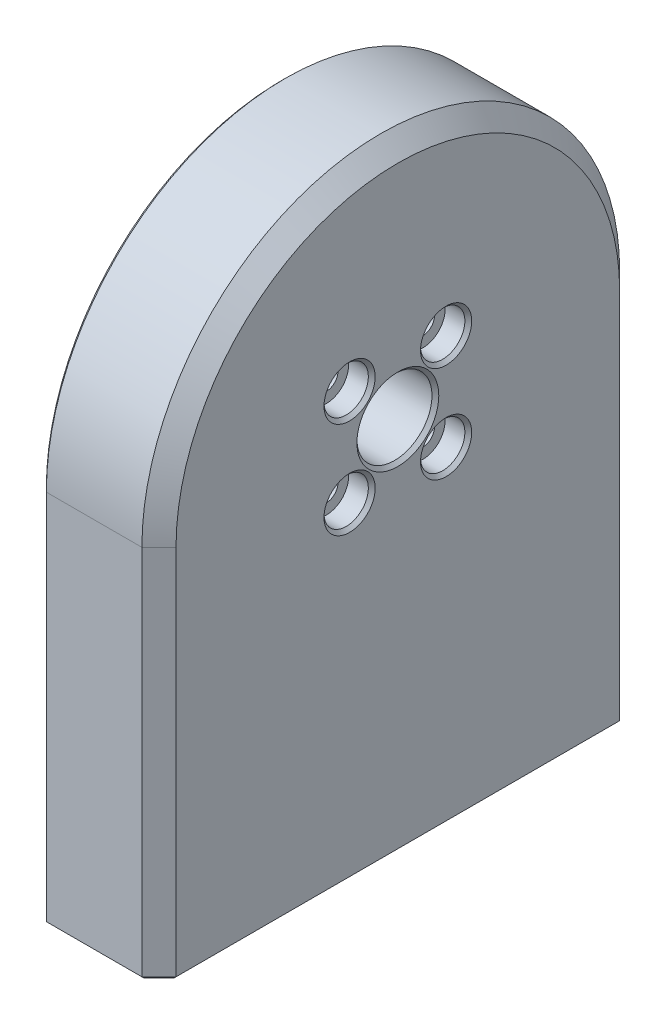
from build123d import *

# Parameters (mm, degrees)
SKETCH1_R                                           = 35
SKETCH1_R_2                                         = 5.5
SKETCH1_R_3                                         = 17
BOSS_EXTRUDE1_DEPTH                                 = 17
BOSS_EXTRUDE2_START                                 = -0.5
SKETCH1_3_R                                         = 17
SKETCH1_3_R_2                                       = 5.5
BOSS_EXTRUDE2_DEPTH                                 = 0.5
CBORE_FOR_M3_HEX_SOCKET_HEAD_CAP_SCREW1_D           = 3.4
CBORE_FOR_M3_HEX_SOCKET_HEAD_CAP_SCREW1_CBORE_D     = 6.5
CBORE_FOR_M3_HEX_SOCKET_HEAD_CAP_SCREW1_CBORE_DEPTH = 3.4
F_5_6_5_6_DIAMETER_HOLE1_D                          = 5.6
F_5_6_5_6_DIAMETER_HOLE1_DEPTH                      = 8
F_5_6_5_6_DIAMETER_HOLE1_TIP                        = 1.682409733
F_2_5MM_CHAMFER1_SIZE                               = 2.5
F_0_5MM_CHAMFER2_SIZE                               = 0.5


with BuildPart() as part:
    # Sketch1 → Boss-Extrude1 (new body)
    # profile 1 of 3: a face of its own
    with BuildSketch(Plane(origin=(0, 0, 0), x_dir=(0, 0, -1), z_dir=(1, 0, 0))):
        Circle(SKETCH1_R)
        Circle(SKETCH1_R_2, mode=Mode.SUBTRACT)
    # profile 2 of 3: a face of its own
    with BuildSketch(Plane(origin=(0, 0, 0), x_dir=(0, 0, -1), z_dir=(1, 0, 0))):
        with BuildLine():
            ThreePointArc((35, 0), (0, -35), (-35, 0))
            Line((-35, 0), (-35, -55))
            Line((-35, -55), (35, -55))
            Line((35, -55), (35, 0))
        make_face()
    # profile 3 of 3: a face of its own
    with BuildSketch(Plane(origin=(0, 0, 0), x_dir=(0, 0, -1), z_dir=(1, 0, 0))):
        Circle(SKETCH1_R_3)
        Circle(SKETCH1_R_2, mode=Mode.SUBTRACT)
    extrude(amount=BOSS_EXTRUDE1_DEPTH)

    # Sketch1<3> → Boss-Extrude2 (add)
    with BuildSketch(Plane(origin=(0, 0, 0), x_dir=(0, 0, -1), z_dir=(1, 0, 0)).offset(BOSS_EXTRUDE2_START)):
        Circle(SKETCH1_3_R)
        Circle(SKETCH1_3_R_2, mode=Mode.SUBTRACT)
    extrude(amount=BOSS_EXTRUDE2_DEPTH)

    # CBORE for M3 Hex Socket Head Cap Screw1 (through all)
    with Locations(Plane(origin=(17, 0, 0), x_dir=(0, 0, -1), z_dir=(1, 0, 0))):
        with Locations((-7.071067812, 7.071067812), (7.071067812, 7.071067812), (7.071067812, -7.071067812), (-7.071067812, -7.071067812)):
            CounterBoreHole(CBORE_FOR_M3_HEX_SOCKET_HEAD_CAP_SCREW1_D / 2, CBORE_FOR_M3_HEX_SOCKET_HEAD_CAP_SCREW1_CBORE_D / 2, CBORE_FOR_M3_HEX_SOCKET_HEAD_CAP_SCREW1_CBORE_DEPTH)

    # Ø5.6 (5.6) Diameter Hole1
    with Locations(Plane(origin=(0, -55, 0), x_dir=(-1, 0, 0), z_dir=(0, -1, 0))):
        with Locations((-8.5, -20.2), (-8.5, 21.2), (-8.5, 7.4), (-8.5, -6.4)):
            Hole(F_5_6_5_6_DIAMETER_HOLE1_D / 2, depth=F_5_6_5_6_DIAMETER_HOLE1_DEPTH)
            with Locations((0, 0, -(F_5_6_5_6_DIAMETER_HOLE1_DEPTH + F_5_6_5_6_DIAMETER_HOLE1_TIP / 2))):  # 118° drill point
                Cone(0, F_5_6_5_6_DIAMETER_HOLE1_D / 2, F_5_6_5_6_DIAMETER_HOLE1_TIP, mode=Mode.SUBTRACT)

    # 2,5mm Chamfer1
    f_2_5mm_chamfer1_edges = [part.edges().sort_by_distance(p)[0] for p in [
        (17, -27.5, 35),
        (17, -27.5, -35),
        (17, 35, 0),
    ]]
    chamfer(f_2_5mm_chamfer1_edges, length=F_2_5MM_CHAMFER1_SIZE)

    # 0,5mm Chamfer2
    f_0_5mm_chamfer2_edges = [part.edges().sort_by_distance(p)[0] for p in [
        (17, 0, 5.5),
        (17, 7.071067812, 10.321067812),
        (-0.5, 7.071067812, 5.371067812),
        (17, -7.071067812, 10.321067812),
        (-0.5, -7.071067812, 5.371067812),
        (17, -7.071067812, -3.821067812),
        (-0.5, -7.071067812, -8.771067812),
        (17, 7.071067812, -3.821067812),
        (-0.5, 7.071067812, -8.771067812),
        (5.7, -55, 20.2),
        (5.7, -55, 6.4),
        (5.7, -55, -7.4),
        (5.7, -55, -21.2),
        (0, -27.5, -35),
        (7.25, -55, -35),
        (17, -55, 0),
        (7.25, -55, 35),
        (0, -55, 0),
        (15.75, -55, 33.75),
        (15.75, -55, -33.75),
        (0, -27.5, 35),
        (0, 35, 0),
    ]]
    chamfer(f_0_5mm_chamfer2_edges, length=F_0_5MM_CHAMFER2_SIZE)


solid = part.part
